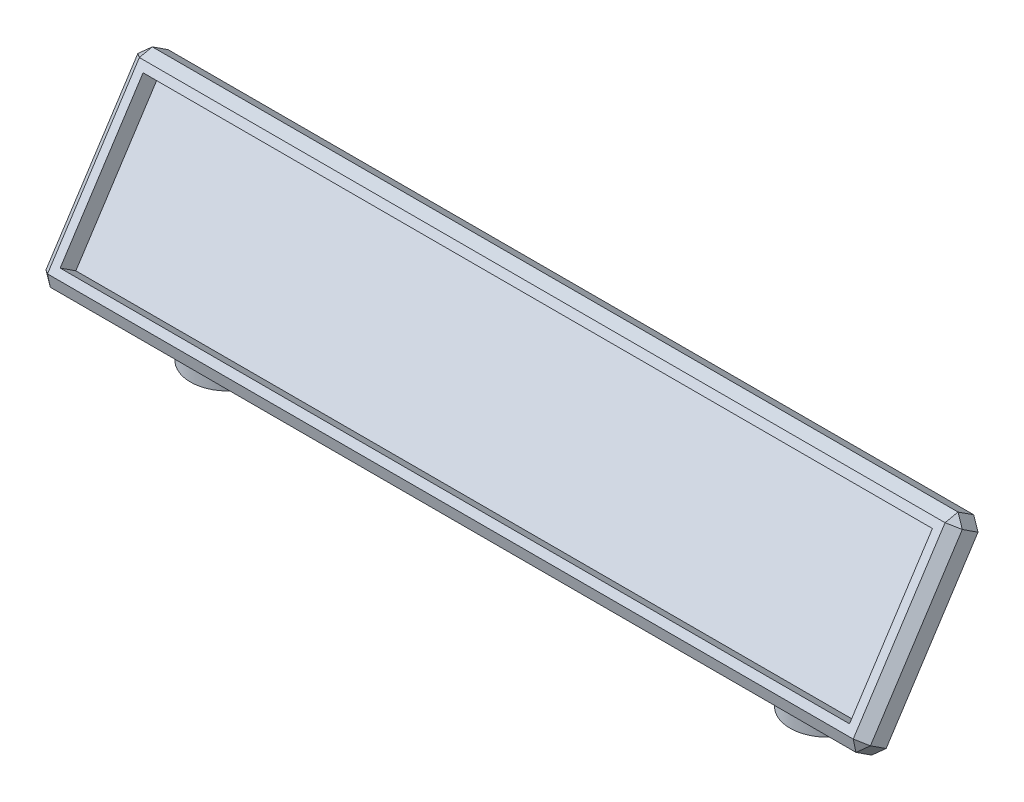
from build123d import *

# Parameters (mm, degrees)
SKETCH2_R             = 6.35
BOSS_EXTRUDE1_DEPTH   = 19.05
BOSS_EXTRUDE1_2_DEPTH = 19.05
SKETCH3_W             = 139.7
SKETCH3_H             = 31.75
BOSS_EXTRUDE2_DEPTH   = 6.35
BOSS_EXTRUDE3_REACH   = 75.737
SKETCH9_W             = 133.75
SKETCH9_H             = 25.8
CUT_EXTRUDE1_DEPTH    = 3.175
CHAMFER2_SIZE         = 1.5875
HOLE1_D               = 5.715
HOLE1_DEPTH           = 12.7
HOLE1_CBORE_D         = 6.604
HOLE1_CBORE_DEPTH     = 0.6858


with BuildPart() as part:
    # Sketch2 → Boss-Extrude1 (new body)
    with BuildSketch(Plane(origin=(0, 0, 0), x_dir=(1, 0, 0), z_dir=(0, 1, 0))):
        with Locations((-50.8, 0)):
            Circle(SKETCH2_R)
    extrude(amount=BOSS_EXTRUDE1_DEPTH)



with BuildPart() as body_2:
    # Sketch2 → Boss-Extrude1 2 (new body)
    with BuildSketch(Plane(origin=(0, 0, 0), x_dir=(1, 0, 0), z_dir=(0, 1, 0))):
        with Locations((50.8, 0)):
            Circle(SKETCH2_R)
    extrude(amount=BOSS_EXTRUDE1_2_DEPTH)


with BuildPart() as part_1:
    add(part.part)

    add(body_2.part)  # Boss-Extrude2 merges body 2
    # Sketch3 → Boss-Extrude2 (add)
    with BuildSketch(Plane(origin=(0, 5.650833475, 8.701520484), x_dir=(-1, 0, 0), z_dir=(0, 0.5446390350150281, 0.8386705679454234))):
        with Locations((0, -15.976674319)):
            Rectangle(SKETCH3_W, SKETCH3_H)
    extrude(amount=BOSS_EXTRUDE2_DEPTH)

    # Sketch8 → Boss-Extrude3 (add, up to next)
    with BuildSketch(Plane(origin=(0, 19.05, 0), x_dir=(1, 0, 0), z_dir=(0, 1, 0)), mode=Mode.PRIVATE) as boss_extrude3_sk1:
        with BuildLine():
            ThreePointArc((57.15, 0), (50.8, 6.35), (44.45, 0))
            Line((44.45, 0), (57.15, 0))
        make_face()
    boss_extrude3_tool1 = extrude(boss_extrude3_sk1.sketch, amount=BOSS_EXTRUDE3_REACH, mode=Mode.PRIVATE) - part_1.part
    # Sketch8 → Boss-Extrude3 (add, up to next)
    with BuildSketch(Plane(origin=(0, 19.05, 0), x_dir=(1, 0, 0), z_dir=(0, 1, 0)), mode=Mode.PRIVATE) as boss_extrude3_sk2:
        with BuildLine():
            ThreePointArc((-44.45, 0), (-50.8, 6.35), (-57.15, 0))
            Line((-57.15, 0), (-44.45, 0))
        make_face()
    boss_extrude3_tool2 = extrude(boss_extrude3_sk2.sketch, amount=BOSS_EXTRUDE3_REACH, mode=Mode.PRIVATE) - part_1.part
    add(boss_extrude3_tool1.solids().sort_by_distance((50.8, 19.05, -2.695024))[0])
    add(boss_extrude3_tool2.solids().sort_by_distance((-50.8, 19.05, -2.695024))[0])

    # Sketch9 → Cut-Extrude1 (cut)
    with BuildSketch(Plane(origin=(0, 9.109291347, 14.02707859), x_dir=(1, 0, 0), z_dir=(0, 0.5446390350150282, 0.8386705679454234))):
        with Locations((0, 15.976674319)):
            Rectangle(SKETCH9_W, SKETCH9_H)
    extrude(amount=-CUT_EXTRUDE1_DEPTH, mode=Mode.SUBTRACT)

    # Chamfer2
    chamfer2_edges = [part_1.edges().sort_by_distance(p)[0] for p in [
        (-69.85, 19.05, 0),
        (0, 32.363895266, -8.646144681),
        (69.85, 19.05, 0),
        (0, 5.736104734, 8.646144681),
        (0, 9.194562606, 13.971702787),
        (-69.85, 7.46533367, 11.308923734),
        (-69.85, 22.508457872, 5.325558106),
        (69.85, 7.46533367, 11.308923734),
        (69.85, 22.508457872, 5.325558106),
        (69.85, 34.093124202, -5.983365628),
        (0, 35.822353138, -3.320586574),
        (-69.85, 34.093124202, -5.983365628),
    ]]
    chamfer(chamfer2_edges, length=CHAMFER2_SIZE)

    # Hole1
    with Locations(Plane(origin=(-50.8, 0, 0), x_dir=(0, 0, -1), z_dir=(0, -1, 0))):
        with Locations((0, 0), (0, 101.6)):
            CounterBoreHole(HOLE1_D / 2, HOLE1_CBORE_D / 2, HOLE1_CBORE_DEPTH, depth=HOLE1_DEPTH)


solid = part_1.part
